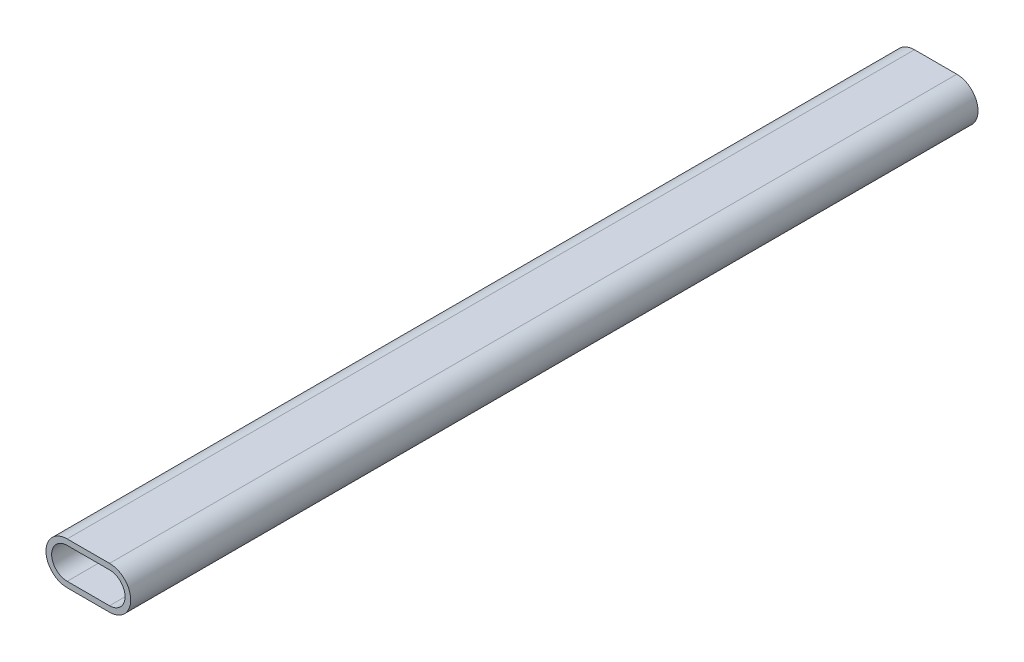
from build123d import *

# Parameters (mm, degrees)
EXTRUDE_1_DEPTH = 300


with BuildPart() as part:
    # Эскиз1 → Бобышка-Вытянуть1 (new body)
    with BuildSketch(Plane.XY):
        with BuildLine():
            Line((-7.5, 7.5), (7.5, 7.5))
            ThreePointArc((7.5, 7.5), (15, 0), (7.5, -7.5))
            Line((7.5, -7.5), (-7.5, -7.5))
            ThreePointArc((-7.5, -7.5), (-15, 0), (-7.5, 7.5))
        make_face()
        with BuildLine():
            Line((-7.5, 5.5), (7.5, 5.5))
            ThreePointArc((7.5, 5.5), (13, 0), (7.5, -5.5))
            Line((7.5, -5.5), (-7.5, -5.5))
            ThreePointArc((-7.5, -5.5), (-13, 0), (-7.5, 5.5))
        make_face(mode=Mode.SUBTRACT)
    extrude(amount=EXTRUDE_1_DEPTH)


solid = part.part
